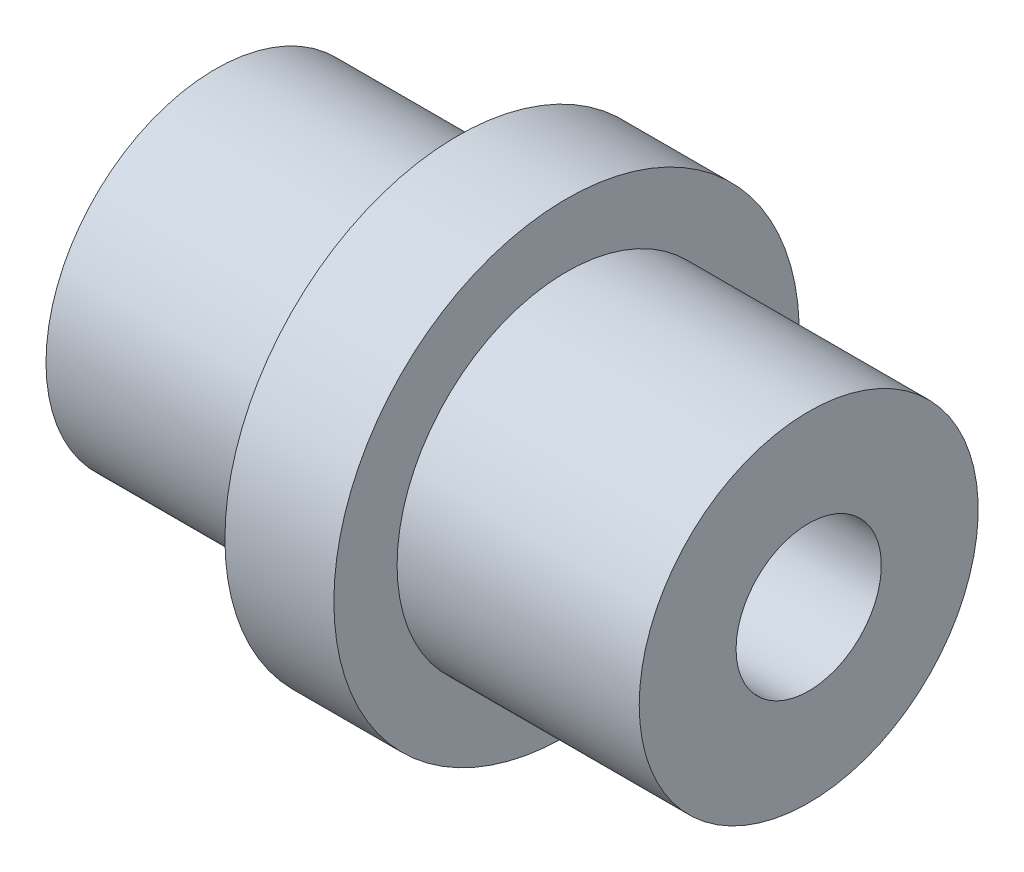
from build123d import *


with BuildPart() as part:
    # Schizzo1 → Rivoluzione1 (revolve)
    with BuildSketch(Plane.XY, mode=Mode.PRIVATE) as rivoluzione1_sk:
        Polygon((0, 3), (0, 7), (10, 7), (10, 9.610959532), (14.5, 9.610959532), (14.5, 7), (24.5, 7), (24.5, 3), align=None)
    revolve(rivoluzione1_sk.sketch.rotate(Axis((0, 0, 0), (1, 0, 0)), 90), axis=Axis((0, 0, 0), (1, 0, 0)))


solid = part.part
